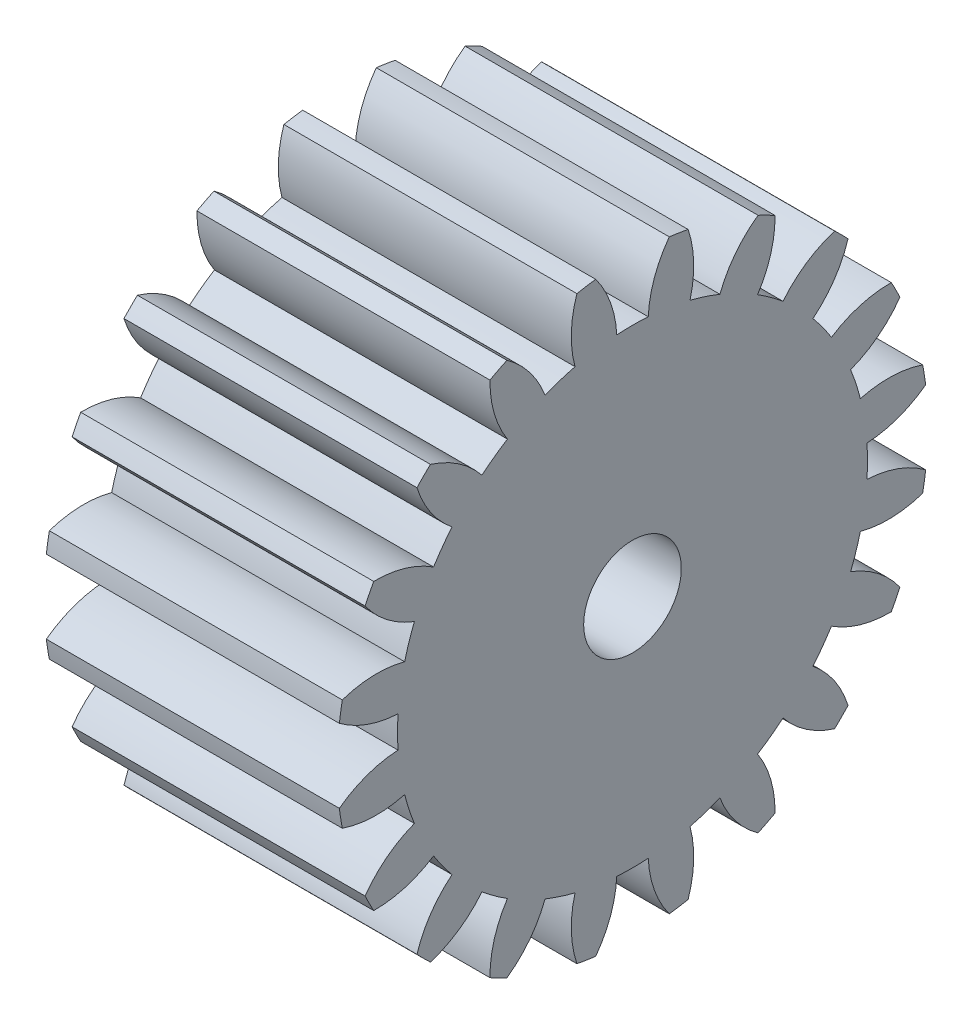
from build123d import *

# Parameters (mm, degrees)
BASPROSKE_W     = 15
BASPROSKE_H     = 15.125
TOOTHCUT_DEPTH  = 27.125299041
TEETHCUTS_COUNT = 20
BORSKE_R        = 2.5
BORE_DEPTH      = 50.0000508


with BuildPart() as part:
    # BasProSke → Base-Revolve (revolve)
    with BuildSketch(Plane(origin=(0, 0, 0), x_dir=(1, 0, 0), z_dir=(0, 1, 0)), mode=Mode.PRIVATE) as base_revolve_sk:
        with Locations((7.5, 7.5625)):
            Rectangle(BASPROSKE_W, BASPROSKE_H)
    revolve(base_revolve_sk.sketch.rotate(Axis((-10, 0, 0), (1, 0, 0)), 180), axis=Axis((-10, 0, 0), (1, 0, 0)))

    # TooCutSke → ToothCut (cut, through all)
    with BuildSketch(Plane(origin=(0, 0, 0), x_dir=(0, 0, -1), z_dir=(1, 0, 0))):
        with BuildLine():
            ThreePointArc((0.805402304, 12.003259649), (0, 12.03025), (-0.805402304, 12.003259649))
            ThreePointArc((-0.805402304, 12.003259649), (-1.12659346, 13.598917809), (-1.900738704, 15.030695677))
            ThreePointArc((-1.900738704, 15.030695677), (0, 15.1504), (1.900738704, 15.030695677))
            ThreePointArc((1.900738704, 15.030695677), (1.12659346, 13.598917809), (0.805402304, 12.003259649))
        make_face()
    toothcut = extrude(amount=TOOTHCUT_DEPTH, mode=Mode.SUBTRACT)

    # TeethCuts: ToothCut ×20 about axis
    teethcuts_axis = Axis((0, 0, 0), (1, 0, 0))
    for i in range(1, TEETHCUTS_COUNT):
        add(toothcut.rotate(teethcuts_axis, i * 360 / TEETHCUTS_COUNT), mode=Mode.SUBTRACT)

    # BorSke → Bore (cut, symmetric)
    with BuildSketch(Plane(origin=(0, 0, 0), x_dir=(0, 0, -1), z_dir=(1, 0, 0))):
        with Locations(Location((0, 0, 0), (0, 0, 180))):
            Circle(BORSKE_R)
    extrude(amount=BORE_DEPTH, both=True, mode=Mode.SUBTRACT)


solid = part.part
